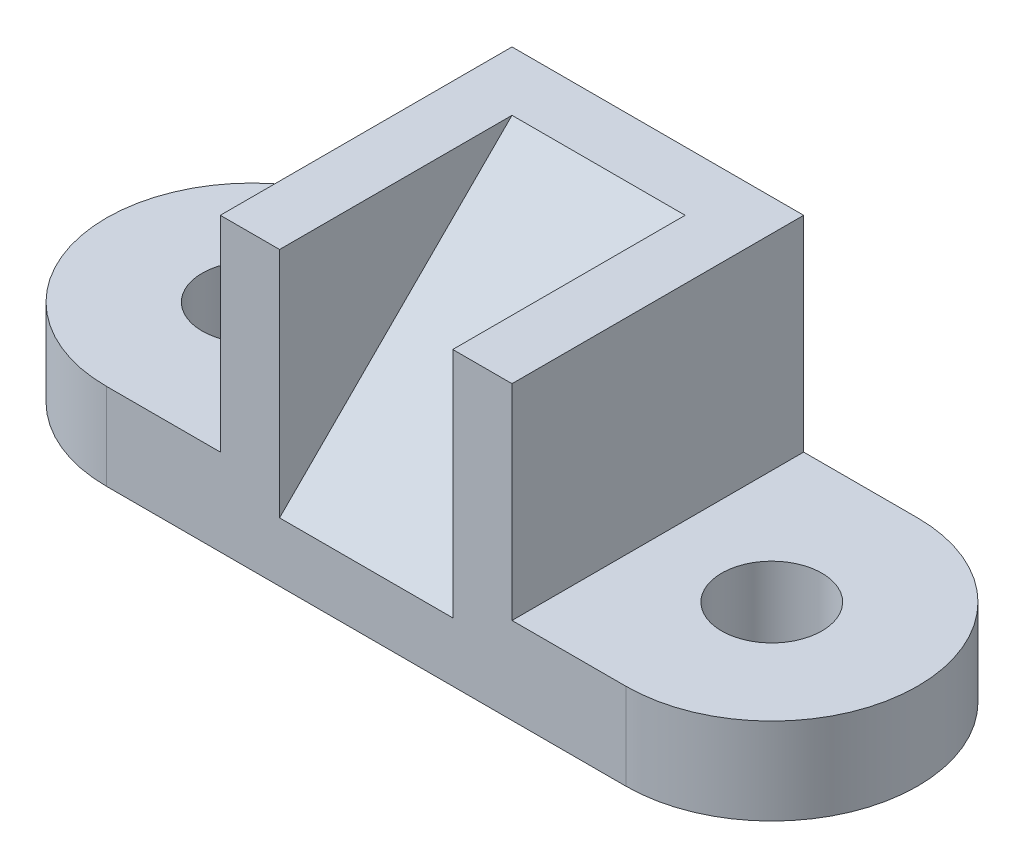
from build123d import *

# Parameters (mm, degrees)
SKETCH1_R           = 11
BOSS_EXTRUDE1_DEPTH = 19
SKETCH2_W           = 64
SKETCH2_H           = 64
BOSS_EXTRUDE2_DEPTH = 45
CUT_EXTRUDE2_DEPTH  = 19


with BuildPart() as part:
    # Sketch1 → Boss-Extrude1 (new body)
    with BuildSketch(Plane(origin=(0, 0, 0), x_dir=(1, 0, 0), z_dir=(0, 1, 0))):
        with BuildLine():
            Line((-57, 32), (57, 32))
            ThreePointArc((57, 32), (89, 0), (57, -32))
            Line((57, -32), (-57, -32))
            ThreePointArc((-57, -32), (-89, 0), (-57, 32))
        make_face()
        with Locations(Location((-57, 0, 0), (0, 0, 270))):
            Circle(SKETCH1_R, mode=Mode.SUBTRACT)
        with Locations(Location((57, 0, 0), (0, 0, 270))):
            Circle(SKETCH1_R, mode=Mode.SUBTRACT)
    extrude(amount=BOSS_EXTRUDE1_DEPTH)

    # Sketch2 → Boss-Extrude2 (add)
    with BuildSketch(Plane(origin=(0, 19, 0), x_dir=(1, 0, 0), z_dir=(0, 1, 0))):
        Rectangle(SKETCH2_W, SKETCH2_H)
    extrude(amount=BOSS_EXTRUDE2_DEPTH)

    # Sketch3 → Cut-Extrude2 (cut, symmetric)
    with BuildSketch(Plane(origin=(0, 0, 0), x_dir=(0, 0, -1), z_dir=(1, 0, 0))):
        Polygon((-32, 13), (-32, 64), (19, 64), align=None)
    extrude(amount=CUT_EXTRUDE2_DEPTH, both=True, mode=Mode.SUBTRACT)


solid = part.part
